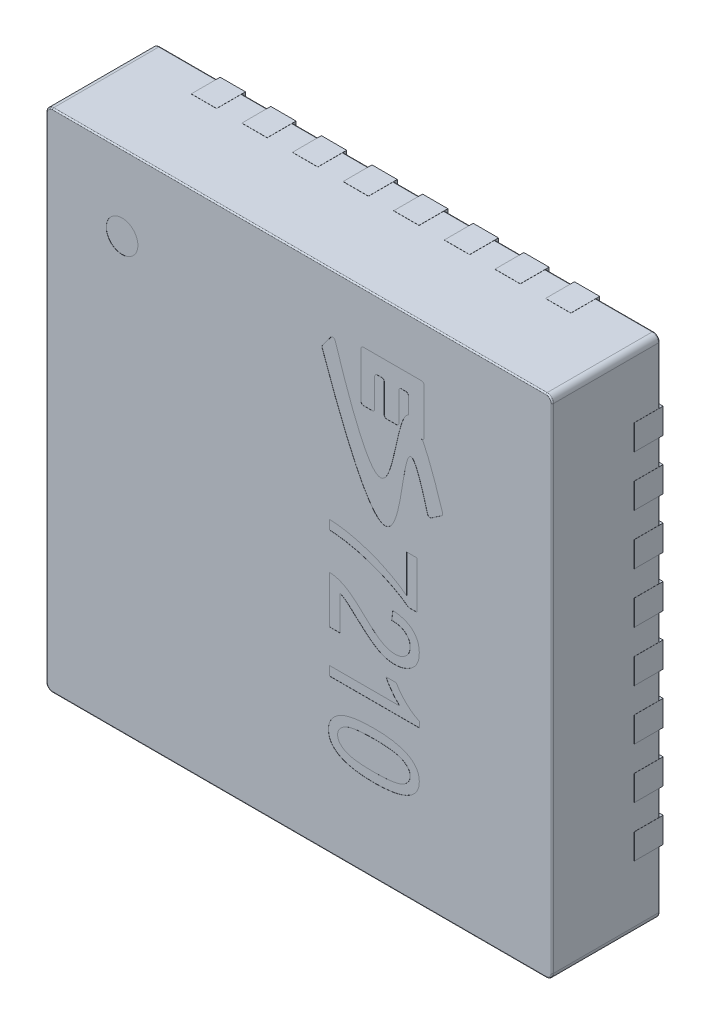
from build123d import *

# Parameters (mm, degrees)
SKETCH1_W                = 4
SKETCH1_H                = 4
BOSS_EXTRUDE1_DEPTH      = 0.85
FILLET1_R                = 0.05
FILLET2_R                = 0.01
BOSS_EXTRUDE2_DEPTH      = 0.025
BOSS_EXTRUDE2_DEPTH_BACK = 0.203
SKETCH2_W                = 0.2
SKETCH2_H                = 0.3
SKETCH2_W_2              = 0.3
SKETCH2_H_2              = 0.2
SKETCH3_R                = 0.125
CUT_EXTRUDE1_DEPTH       = 0.001
BODY_MOVE_COPY1_ANGLE    = 180


with BuildPart() as part:
    # Sketch1 → Boss-Extrude1 (new body)
    with BuildSketch(Plane(origin=(0, 0, 0), x_dir=(1, 0, 0), z_dir=(0, 1, 0))):
        Rectangle(SKETCH1_W, SKETCH1_H)
    extrude(amount=BOSS_EXTRUDE1_DEPTH)

    # Fillet1
    fillet1_edges = [part.edges().sort_by_distance(p)[0] for p in [
        (2, 0.425, 2),
        (-2, 0.425, 2),
        (-2, 0.425, -2),
        (2, 0.425, -2),
    ]]
    fillet(fillet1_edges, radius=FILLET1_R)

    # Fillet2
    fillet2_edges = [part.edges().sort_by_distance(p)[0] for p in [
        (0, 0, -2),
        (0, 0.85, -2),
        (2, 0, 0),
        (0, 0, 2),
        (-2, 0, 0),
        (-1.985355339, 0, -1.985355339),
        (-1.985355339, 0, 1.985355339),
        (1.985355339, 0, 1.985355339),
        (1.985355339, 0, -1.985355339),
        (2, 0.85, 0),
        (-2, 0.85, 0),
        (0, 0.85, 2),
        (-1.985355339, 0.85, -1.985355339),
        (-1.985355339, 0.85, 1.985355339),
        (1.985355339, 0.85, 1.985355339),
        (1.985355339, 0.85, -1.985355339),
    ]]
    fillet(fillet2_edges, radius=FILLET2_R)

    # Sketch2 → Boss-Extrude2 (add, two sides: drawn at the far end of the back side and taken through both)
    with BuildSketch(Plane.XZ.offset(-BOSS_EXTRUDE2_DEPTH_BACK)):
        with BuildLine():
            Line((1.1, 1.4), (1.4, 1.1))
            Line((1.4, 1.1), (1.4, -1.35))
            ThreePointArc((1.4, -1.35), (1.385355339, -1.385355339), (1.35, -1.4))
            Line((1.35, -1.4), (-1.35, -1.4))
            ThreePointArc((-1.35, -1.4), (-1.385355339, -1.385355339), (-1.4, -1.35))
            Line((-1.4, -1.35), (-1.4, 1.35))
            ThreePointArc((-1.4, 1.35), (-1.385355339, 1.385355339), (-1.35, 1.4))
            Line((-1.35, 1.4), (1.1, 1.4))
        make_face()
        with Locations((-0.2, 1.851)):
            Rectangle(SKETCH2_W, SKETCH2_H)
        with Locations((-0.6, 1.851)):
            Rectangle(SKETCH2_W, SKETCH2_H)
        with Locations((-1, 1.851)):
            Rectangle(SKETCH2_W, SKETCH2_H)
        with Locations((-1.4, 1.851)):
            Rectangle(SKETCH2_W, SKETCH2_H)
        with Locations((1.4, 1.851)):
            Rectangle(SKETCH2_W, SKETCH2_H)
        with Locations((1, 1.851)):
            Rectangle(SKETCH2_W, SKETCH2_H)
        with Locations((0.6, 1.851)):
            Rectangle(SKETCH2_W, SKETCH2_H)
        with Locations((0.2, 1.851)):
            Rectangle(SKETCH2_W, SKETCH2_H)
        with Locations((0.2, -1.851)):
            Rectangle(SKETCH2_W, SKETCH2_H)
        with Locations((0.6, -1.851)):
            Rectangle(SKETCH2_W, SKETCH2_H)
        with Locations((1, -1.851)):
            Rectangle(SKETCH2_W, SKETCH2_H)
        with Locations((1.4, -1.851)):
            Rectangle(SKETCH2_W, SKETCH2_H)
        with Locations((-1.4, -1.851)):
            Rectangle(SKETCH2_W, SKETCH2_H)
        with Locations((-1, -1.851)):
            Rectangle(SKETCH2_W, SKETCH2_H)
        with Locations((-0.6, -1.851)):
            Rectangle(SKETCH2_W, SKETCH2_H)
        with Locations((-0.2, -1.851)):
            Rectangle(SKETCH2_W, SKETCH2_H)
        with Locations((1.851, 0.2)):
            Rectangle(SKETCH2_W_2, SKETCH2_H_2)
        with Locations((1.851, 0.6)):
            Rectangle(SKETCH2_W_2, SKETCH2_H_2)
        with Locations((1.851, 1)):
            Rectangle(SKETCH2_W_2, SKETCH2_H_2)
        with Locations((1.851, 1.4)):
            Rectangle(SKETCH2_W_2, SKETCH2_H_2)
        with Locations((1.851, -1.4)):
            Rectangle(SKETCH2_W_2, SKETCH2_H_2)
        with Locations((1.851, -1)):
            Rectangle(SKETCH2_W_2, SKETCH2_H_2)
        with Locations((1.851, -0.6)):
            Rectangle(SKETCH2_W_2, SKETCH2_H_2)
        with Locations((1.851, -0.2)):
            Rectangle(SKETCH2_W_2, SKETCH2_H_2)
        with Locations((-1.851, -0.2)):
            Rectangle(SKETCH2_W_2, SKETCH2_H_2)
        with Locations((-1.851, -0.6)):
            Rectangle(SKETCH2_W_2, SKETCH2_H_2)
        with Locations((-1.851, -1)):
            Rectangle(SKETCH2_W_2, SKETCH2_H_2)
        with Locations((-1.851, -1.4)):
            Rectangle(SKETCH2_W_2, SKETCH2_H_2)
        with Locations((-1.851, 1.4)):
            Rectangle(SKETCH2_W_2, SKETCH2_H_2)
        with Locations((-1.851, 1)):
            Rectangle(SKETCH2_W_2, SKETCH2_H_2)
        with Locations((-1.851, 0.6)):
            Rectangle(SKETCH2_W_2, SKETCH2_H_2)
        with Locations((-1.851, 0.2)):
            Rectangle(SKETCH2_W_2, SKETCH2_H_2)
    extrude(amount=BOSS_EXTRUDE2_DEPTH + BOSS_EXTRUDE2_DEPTH_BACK)

    # Sketch3 → Cut-Extrude1 (cut)
    # profile 1 of 6: a face of its own
    with BuildSketch(Plane(origin=(0, 0.85, 0), x_dir=(1, 0, 0), z_dir=(0, 1, 0))):
        with Locations(Location((1.4, -1.4, 0), (0, 0, 270))):
            Circle(SKETCH3_R)
    # profile 2 of 6: a face of its own
    with BuildSketch(Plane(origin=(0, 0.85, 0), x_dir=(1, 0, 0), z_dir=(0, 1, 0))):
        with BuildLine():
            Line((-0.967195361, -1.594112014), (-0.507195361, -1.594112014))
            ThreePointArc((-0.507195361, -1.594112014), (-0.493053225, -1.58825415), (-0.487195361, -1.574112014))
            Line((-0.487195361, -1.574112014), (-0.487195361, -1.214112014))
            ThreePointArc((-0.487195361, -1.214112014), (-0.493053225, -1.199969879), (-0.507195361, -1.194112014))
            Line((-0.507195361, -1.194112014), (-0.576695361, -1.194112014))
            ThreePointArc((-0.576695361, -1.194112014), (-0.590837496, -1.199969879), (-0.596695361, -1.214112014))
            Line((-0.596695361, -1.214112014), (-0.596695361, -1.43881669))
            ThreePointArc((-0.596695361, -1.43881669), (-0.602553225, -1.452958826), (-0.616695361, -1.45881669))
            Line((-0.616695361, -1.45881669), (-0.651695361, -1.45881669))
            ThreePointArc((-0.651695361, -1.45881669), (-0.665837496, -1.452958826), (-0.671695361, -1.43881669))
            Line((-0.671695361, -1.43881669), (-0.671695361, -1.214112014))
            ThreePointArc((-0.671695361, -1.214112014), (-0.677553225, -1.199969879), (-0.691695361, -1.194112014))
            Line((-0.691695361, -1.194112014), (-0.767195361, -1.194112014))
            ThreePointArc((-0.767195361, -1.194112014), (-0.781337496, -1.199969879), (-0.787195361, -1.214112014))
            Line((-0.787195361, -1.214112014), (-0.787195361, -1.43881669))
            ThreePointArc((-0.787195361, -1.43881669), (-0.793053225, -1.452958826), (-0.807195361, -1.45881669))
            Line((-0.807195361, -1.45881669), (-0.842195361, -1.45881669))
            ThreePointArc((-0.842195361, -1.45881669), (-0.856337496, -1.452958826), (-0.862195361, -1.43881669))
            Line((-0.862195361, -1.43881669), (-0.862195361, -1.307431039))
            add(Edge.make_bspline(
                [(-0.862195361, -1.307431039), (-0.709994935, -1.242658459), (-0.771564782, 0.001033819), (-0.284294728, -1.527332574)],
                knots=[0, 0, 0, 0, 1, 1, 1, 1], degree=3))
            ThreePointArc((-0.284294728, -1.527332574), (-0.268507259, -1.540988775), (-0.249160324, -1.53315091))
            Line((-0.249160324, -1.53315091), (-0.183916313, -1.444943735))
            ThreePointArc((-0.183916313, -1.444943735), (-0.180216037, -1.436010858), (-0.18113868, -1.426386043))
            add(Edge.make_bspline(
                [(-1.013763344, -0.705263683), (-0.67867948, -1.952511139), (-1.02099538, 0.950043529), (-0.18113868, -1.426386043)],
                knots=[0, 0, 0, 0, 1, 1, 1, 1], degree=3))
            ThreePointArc((-1.013763344, -0.705263683), (-1.026156587, -0.691688839), (-1.044396518, -0.693963431))
            Line((-1.044396518, -0.693963431), (-1.125676764, -0.749752966))
            ThreePointArc((-1.125676764, -0.749752966), (-1.133273701, -0.759744551), (-1.133420709, -0.772295392))
            add(Edge.make_bspline(
                [(-1.133420709, -0.772295392), (-1.068956851, -0.975303912), (-1.017273228, -1.1102017), (-0.97506474, -1.194112014)],
                knots=[0, 0, 0, 0, 1, 1, 1, 1], degree=3))
            Line((-0.97506474, -1.194112014), (-0.967195361, -1.194112014))
            ThreePointArc((-0.967195361, -1.194112014), (-0.981337496, -1.199969879), (-0.987195361, -1.214112014))
            Line((-0.987195361, -1.214112014), (-0.987195361, -1.574112014))
            ThreePointArc((-0.987195361, -1.574112014), (-0.981337496, -1.58825415), (-0.967195361, -1.594112014))
        make_face()
    # profile 3 of 6: a face of its own
    with BuildSketch(Plane(origin=(0, 0.85, 0), x_dir=(1, 0, 0), z_dir=(0, 1, 0))):
        with BuildLine():
            Line((-0.849090909, -0.363636364), (-0.930909091, -0.363636364))
            Line((-0.930909091, -0.363636364), (-0.930909091, 0.009090909))
            Line((-0.930909091, 0.009090909), (-0.864005682, 0.009090909))
            add(Edge.make_bspline(
                [(-0.864005682, 0.009090909), (-0.854746998, 0.002175362), (-0.835901379, -0.011900911), (-0.805755794, -0.031586208), (-0.773650229, -0.050730904), (-0.739557737, -0.069353456), (-0.703367983, -0.087233057), (-0.665197538, -0.104558207), (-0.624931677, -0.121118576), (-0.583090128, -0.137068866), (-0.540254593, -0.151918182), (-0.497083227, -0.16510485), (-0.453981374, -0.176674327), (-0.410979444, -0.186394912), (-0.368129646, -0.194739112), (-0.325383412, -0.201237901), (-0.282690704, -0.206142227), (-0.254213856, -0.208109146), (-0.24, -0.209090909)],
                knots=[0, 0, 0, 0, 0.828228242, 1.685820058, 2.579325365, 3.507361607, 4.469713273, 5.472243924, 6.511632332, 7.590183537, 8.68180921, 9.76082494, 10.825356942, 11.880104434, 12.920528634, 13.95402052, 14.978775448, 16, 16, 16, 16], degree=3))
            Line((-0.24, -0.209090909), (-0.24, -0.281818182))
            add(Edge.make_bspline(
                [(-0.24, -0.281818182), (-0.247484192, -0.281593654), (-0.262751944, -0.281135617), (-0.286093818, -0.279293748), (-0.31036802, -0.276991466), (-0.335550688, -0.27347466), (-0.36165466, -0.26925248), (-0.388669602, -0.264040985), (-0.416654206, -0.258319967), (-0.455000814, -0.249147711), (-0.50299956, -0.23626294), (-0.559526426, -0.217596113), (-0.614832944, -0.196765783), (-0.668124192, -0.172884669), (-0.718861296, -0.147543439), (-0.765950883, -0.120648322), (-0.809548767, -0.093456313), (-0.836155364, -0.073391457), (-0.849090909, -0.063636364)],
                knots=[0, 0, 0, 0, 0.547560405, 1.117023226, 1.712128439, 2.330702075, 2.976322001, 3.646013224, 4.342857794, 5.065247493, 6.529539093, 7.976213993, 9.417556904, 10.850065343, 12.245478746, 13.563746768, 14.815546979, 16, 16, 16, 16], degree=3))
            Line((-0.849090909, -0.063636364), (-0.849090909, -0.363636364))
        make_face()
    # profile 4 of 6: a face of its own
    with BuildSketch(Plane(origin=(0, 0.85, 0), x_dir=(1, 0, 0), z_dir=(0, 1, 0))):
        with BuildLine():
            Line((-0.321818182, 0.454545455), (-0.24, 0.454545455))
            Line((-0.24, 0.454545455), (-0.24, 0.081818182))
            add(Edge.make_bspline(
                [(-0.24, 0.081818182), (-0.24426307, 0.081800924), (-0.252900118, 0.08176596), (-0.266068061, 0.082928403), (-0.279554808, 0.085316741), (-0.293540272, 0.088366408), (-0.307840523, 0.092690492), (-0.322525009, 0.097984014), (-0.337557319, 0.104229742), (-0.353025884, 0.11154357), (-0.369081507, 0.120087491), (-0.385646973, 0.130408658), (-0.403030028, 0.14220296), (-0.421013902, 0.155756146), (-0.43976953, 0.170824383), (-0.459210041, 0.187482032), (-0.479442256, 0.205659527), (-0.492880467, 0.218613041), (-0.499801136, 0.225284091)],
                knots=[0, 0, 0, 0, 0.672196011, 1.361880106, 2.081368845, 2.831486093, 3.618364569, 4.435734711, 5.292876118, 6.184871288, 7.133796945, 8.159796293, 9.26180684, 10.446293416, 11.710635831, 13.056147575, 14.483918136, 16, 16, 16, 16], degree=3))
            add(Edge.make_bspline(
                [(-0.499801136, 0.225284091), (-0.507818635, 0.233035493), (-0.523255706, 0.247960215), (-0.546049487, 0.268965336), (-0.567236023, 0.288050598), (-0.58719843, 0.30483469), (-0.605664825, 0.31961559), (-0.622608804, 0.332542012), (-0.638414902, 0.342996201), (-0.657013047, 0.354283752), (-0.679153843, 0.365044829), (-0.704962445, 0.374558231), (-0.729911682, 0.380705106), (-0.746360183, 0.381454379), (-0.754346591, 0.381818182)],
                knots=[0, 0, 0, 0, 1.312560889, 2.527233899, 3.64818266, 4.668586789, 5.596397896, 6.432357998, 7.175835261, 7.825761013, 8.992224112, 10.065918602, 11.060925749, 12, 12, 12, 12], degree=3))
            add(Edge.make_bspline(
                [(-0.754346591, 0.381818182), (-0.758755733, 0.381767468), (-0.767367248, 0.381668418), (-0.779943296, 0.379984578), (-0.79190563, 0.377584142), (-0.803338086, 0.37441155), (-0.814062267, 0.369925318), (-0.824153051, 0.364488908), (-0.83374334, 0.358272519), (-0.842500123, 0.351018571), (-0.850399964, 0.343089495), (-0.857472155, 0.334713184), (-0.863252685, 0.325748447), (-0.868040858, 0.316380022), (-0.871704489, 0.306551787), (-0.874449565, 0.296288569), (-0.876009053, 0.285558946), (-0.87624427, 0.27827186), (-0.876363636, 0.274573864)],
                knots=[0, 0, 0, 0, 1.164144409, 2.273695819, 3.345940663, 4.387378487, 5.402712487, 6.410231049, 7.41307794, 8.417484468, 9.408318902, 10.367853362, 11.308274301, 12.220303706, 13.142827832, 14.074469365, 15.022846069, 16, 16, 16, 16], degree=3))
            add(Edge.make_bspline(
                [(-0.876363636, 0.274573864), (-0.876280325, 0.270586651), (-0.876117697, 0.262803428), (-0.87408399, 0.251462156), (-0.871386594, 0.240582485), (-0.867122164, 0.230300411), (-0.861968085, 0.220420081), (-0.855240353, 0.211347943), (-0.847732115, 0.202562245), (-0.838923799, 0.194486264), (-0.828921979, 0.187277415), (-0.81799788, 0.180806559), (-0.805879551, 0.175590996), (-0.792866488, 0.171207876), (-0.778802897, 0.167764938), (-0.763732205, 0.165466248), (-0.747660858, 0.163779689), (-0.736595709, 0.163685017), (-0.730909091, 0.163636364)],
                knots=[0, 0, 0, 0, 0.928593091, 1.812656339, 2.680433, 3.537535669, 4.402074609, 5.272376737, 6.164676777, 7.094647554, 8.050991042, 9.035788945, 10.049325173, 11.121325706, 12.235436061, 13.420862991, 14.67452591, 16, 16, 16, 16], degree=3))
            Line((-0.730909091, 0.163636364), (-0.74, 0.090909091))
            add(Edge.make_bspline(
                [(-0.74, 0.090909091), (-0.748439432, 0.091658565), (-0.764812313, 0.093112579), (-0.788514434, 0.096927802), (-0.810506363, 0.102221062), (-0.831004751, 0.108507961), (-0.849764654, 0.116405422), (-0.867129546, 0.12529418), (-0.882797385, 0.13568872), (-0.896794435, 0.147372015), (-0.909067966, 0.160246164), (-0.919735249, 0.174077077), (-0.928986857, 0.188799674), (-0.936330679, 0.204621169), (-0.942056828, 0.221436903), (-0.946150779, 0.239184202), (-0.948592344, 0.257934124), (-0.948922266, 0.270731308), (-0.949090909, 0.277272727)],
                knots=[0, 0, 0, 0, 1.296016433, 2.514330702, 3.668705393, 4.754684394, 5.790583066, 6.778804856, 7.735156204, 8.660808185, 9.562568342, 10.450784178, 11.329227516, 12.217177451, 13.112894374, 14.042449809, 14.999377131, 16, 16, 16, 16], degree=3))
            add(Edge.make_bspline(
                [(-0.949090909, 0.277272727), (-0.94888512, 0.284336003), (-0.948484415, 0.298089374), (-0.945803395, 0.318100515), (-0.941182234, 0.336820222), (-0.934387737, 0.354112812), (-0.926043344, 0.370166283), (-0.915679928, 0.384835443), (-0.903359473, 0.398105014), (-0.889315115, 0.409903257), (-0.874159238, 0.420332793), (-0.85830965, 0.429432486), (-0.842031109, 0.437325939), (-0.825141914, 0.443494846), (-0.80786888, 0.448646554), (-0.789950131, 0.451882967), (-0.771592427, 0.454161379), (-0.759183373, 0.454416706), (-0.752926136, 0.454545455)],
                knots=[0, 0, 0, 0, 1.141316638, 2.222333051, 3.255980828, 4.24919085, 5.217781249, 6.173073686, 7.14226832, 8.135684626, 9.131102602, 10.111468148, 11.086834621, 12.050425614, 13.014198859, 13.995608887, 14.989290351, 16, 16, 16, 16], degree=3))
            add(Edge.make_bspline(
                [(-0.752926136, 0.454545455), (-0.74728864, 0.454424149), (-0.736087094, 0.454183119), (-0.719373752, 0.452615197), (-0.702885109, 0.449847523), (-0.686462619, 0.446253823), (-0.670360569, 0.441154327), (-0.654323184, 0.435381464), (-0.638531527, 0.428379279), (-0.622676798, 0.42011361), (-0.606200181, 0.410433193), (-0.588791407, 0.398843195), (-0.569995805, 0.385483922), (-0.550034164, 0.370083498), (-0.528685701, 0.352887975), (-0.506119852, 0.333675534), (-0.482290533, 0.312510859), (-0.466112621, 0.29761134), (-0.457755682, 0.289914773)],
                knots=[0, 0, 0, 0, 0.780531358, 1.550893666, 2.321451189, 3.094347453, 3.876089108, 4.657940698, 5.453333384, 6.265487087, 7.132311241, 8.097757185, 9.160053187, 10.324349312, 11.587703087, 12.955031265, 14.427076445, 16, 16, 16, 16], degree=3))
            add(Edge.make_bspline(
                [(-0.457755682, 0.289914773), (-0.452560341, 0.285023853), (-0.442631628, 0.275676912), (-0.428229759, 0.26253033), (-0.415313766, 0.250483586), (-0.403556688, 0.239946161), (-0.393210349, 0.23057589), (-0.383936144, 0.222873657), (-0.376185892, 0.216251049), (-0.363766693, 0.206589622), (-0.346248857, 0.19439656), (-0.329773937, 0.185914282), (-0.321818182, 0.181818182)],
                knots=[0, 0, 0, 0, 1.227426371, 2.345710398, 3.354421158, 4.265580894, 5.061720194, 5.755250507, 6.339260457, 6.815034732, 8.461977265, 10, 10, 10, 10], degree=3))
            Line((-0.321818182, 0.181818182), (-0.321818182, 0.454545455))
        make_face()
    # profile 5 of 6: a face of its own
    with BuildSketch(Plane(origin=(0, 0.85, 0), x_dir=(1, 0, 0), z_dir=(0, 1, 0))):
        with BuildLine():
            Line((-0.24, 0.790909091), (-0.24, 0.718181818))
            Line((-0.24, 0.718181818), (-0.794545455, 0.718181818))
            add(Edge.make_bspline(
                [(-0.794545455, 0.718181818), (-0.789406209, 0.713713641), (-0.778755126, 0.70445335), (-0.763589014, 0.688435906), (-0.74812757, 0.670428211), (-0.732928709, 0.650671264), (-0.718452754, 0.630406634), (-0.705488792, 0.610547441), (-0.694402722, 0.591543002), (-0.688356689, 0.578829739), (-0.685454545, 0.572727273)],
                knots=[0, 0, 0, 0, 0.892632118, 1.84997915, 2.889208393, 4.004565423, 5.117638514, 6.154471911, 7.114131986, 8, 8, 8, 8], degree=3))
            Line((-0.685454545, 0.572727273), (-0.767272727, 0.572727273))
            add(Edge.make_bspline(
                [(-0.767272727, 0.572727273), (-0.7731789, 0.582534966), (-0.784940674, 0.60206637), (-0.80529148, 0.629491945), (-0.827428074, 0.655260654), (-0.851244081, 0.678827193), (-0.875686929, 0.700021117), (-0.900196727, 0.718086477), (-0.924396776, 0.732946131), (-0.941048101, 0.740231211), (-0.949090909, 0.74375)],
                knots=[0, 0, 0, 0, 1.082336866, 2.155405958, 3.2255179, 4.292702086, 5.32152541, 6.282639852, 7.170492597, 8, 8, 8, 8], degree=3))
            Line((-0.949090909, 0.74375), (-0.949090909, 0.790909091))
            Line((-0.949090909, 0.790909091), (-0.24, 0.790909091))
        make_face()
    # profile 6 of 6: a face of its own
    with BuildSketch(Plane(origin=(0, 0.85, 0), x_dir=(1, 0, 0), z_dir=(0, 1, 0))):
        with BuildLine():
            add(Edge.make_bspline(
                [(-0.589715909, 0.972727273), (-0.604018412, 0.972842746), (-0.631790432, 0.973066969), (-0.672070511, 0.975384754), (-0.709701389, 0.97903958), (-0.744631111, 0.98401292), (-0.776869964, 0.99073277), (-0.806495774, 0.998693134), (-0.833425548, 1.008355624), (-0.857681068, 1.019358887), (-0.879167991, 1.031844841), (-0.897818713, 1.045855728), (-0.913786485, 1.061190617), (-0.926741469, 1.078163711), (-0.936787277, 1.096515239), (-0.943969801, 1.116283563), (-0.948315262, 1.137452755), (-0.948828858, 1.152062645), (-0.949090909, 1.159517045)],
                knots=[0, 0, 0, 0, 1.522177082, 2.955701814, 4.292601031, 5.54555501, 6.7088804, 7.795771162, 8.808034672, 9.750647735, 10.627079958, 11.44753433, 12.228026558, 12.97593222, 13.711165822, 14.446140298, 15.20717461, 16, 16, 16, 16], degree=3))
            add(Edge.make_bspline(
                [(-0.949090909, 1.159517045), (-0.948898451, 1.16616437), (-0.948520258, 1.179226781), (-0.944775345, 1.198193618), (-0.939192653, 1.216178565), (-0.930954007, 1.232920051), (-0.920463938, 1.248607501), (-0.907559305, 1.263054513), (-0.892514842, 1.276634902), (-0.881106379, 1.284367464), (-0.875227273, 1.288352273)],
                knots=[0, 0, 0, 0, 1.02455918, 2.013323352, 2.972239719, 3.92313388, 4.881632631, 5.875512573, 6.905191138, 8, 8, 8, 8], degree=3))
            add(Edge.make_bspline(
                [(-0.875227273, 1.288352273), (-0.867315948, 1.292978556), (-0.850863515, 1.302599401), (-0.823296953, 1.314083475), (-0.792467372, 1.32379386), (-0.758343858, 1.331894381), (-0.720854533, 1.337775804), (-0.680151477, 1.342361386), (-0.63605856, 1.345034239), (-0.605533942, 1.345311083), (-0.589715909, 1.345454545)],
                knots=[0, 0, 0, 0, 0.745752227, 1.550870435, 2.425309485, 3.376577511, 4.404263406, 5.514061028, 6.71177208, 8, 8, 8, 8], degree=3))
            add(Edge.make_bspline(
                [(-0.589715909, 1.345454545), (-0.575508009, 1.345339679), (-0.547925061, 1.345116681), (-0.507882681, 1.342789238), (-0.470438832, 1.339148535), (-0.435610757, 1.334144961), (-0.403448985, 1.32749018), (-0.373924215, 1.319414876), (-0.346967726, 1.310012172), (-0.322719415, 1.298920409), (-0.301128286, 1.286475993), (-0.282378901, 1.272560755), (-0.26647384, 1.257172642), (-0.253374994, 1.2403548), (-0.243365099, 1.221879068), (-0.236013237, 1.202111944), (-0.23168278, 1.180821383), (-0.231171017, 1.166165697), (-0.230909091, 1.158664773)],
                knots=[0, 0, 0, 0, 1.514074965, 2.939396442, 4.273020662, 5.522618968, 6.687464393, 7.770909357, 8.782798299, 9.726643008, 10.608576586, 11.434138097, 12.208514389, 12.960468265, 13.696662544, 14.439073904, 15.201102606, 16, 16, 16, 16], degree=3))
            add(Edge.make_bspline(
                [(-0.230909091, 1.158664773), (-0.231160532, 1.15197269), (-0.231654895, 1.138815302), (-0.235406136, 1.119506668), (-0.241894033, 1.101244949), (-0.250749067, 1.083847504), (-0.262323586, 1.067583935), (-0.276222215, 1.052070235), (-0.29282167, 1.037676403), (-0.311884488, 1.023965939), (-0.334119856, 1.011652419), (-0.359967347, 1.001259536), (-0.389338845, 0.99233078), (-0.422442957, 0.985299743), (-0.459072672, 0.979406417), (-0.499405681, 0.975644947), (-0.543330957, 0.97318911), (-0.573850401, 0.97288524), (-0.589715909, 0.972727273)],
                knots=[0, 0, 0, 0, 0.713852874, 1.403515076, 2.08903769, 2.775973907, 3.479633763, 4.213082677, 4.993526966, 5.819329379, 6.714934747, 7.698240864, 8.786642223, 9.986811405, 11.306714678, 12.743554856, 14.307139623, 16, 16, 16, 16], degree=3))
        make_face()
        with BuildLine():
            add(Edge.make_bspline(
                [(-0.59, 1.045454545), (-0.576362746, 1.045582775), (-0.550264232, 1.045828176), (-0.512878959, 1.04714288), (-0.479048426, 1.049681979), (-0.448704662, 1.053158536), (-0.421849609, 1.057626522), (-0.398429871, 1.063011269), (-0.378583683, 1.069618979), (-0.361964252, 1.077234836), (-0.348158011, 1.085809443), (-0.336254117, 1.094734298), (-0.32618691, 1.104279625), (-0.317998535, 1.114473455), (-0.311480524, 1.125181694), (-0.306898443, 1.136546313), (-0.304076608, 1.148488786), (-0.303784276, 1.156660679), (-0.303636364, 1.160795455)],
                knots=[0, 0, 0, 0, 1.930680258, 3.694870612, 5.294765573, 6.732327541, 8.017244644, 9.14720992, 10.130763445, 10.973463911, 11.728776188, 12.427251247, 13.076760965, 13.687074849, 14.273357039, 14.844695938, 15.415444712, 16, 16, 16, 16], degree=3))
            add(Edge.make_bspline(
                [(-0.303636364, 1.160795455), (-0.303771292, 1.164697897), (-0.304039957, 1.17246828), (-0.307111753, 1.18379732), (-0.311629517, 1.194709844), (-0.318138479, 1.205094128), (-0.326694789, 1.214718979), (-0.33686558, 1.224025583), (-0.348875226, 1.232809232), (-0.362866628, 1.241196622), (-0.37954861, 1.248889559), (-0.399560936, 1.255237207), (-0.422934717, 1.260694415), (-0.449689604, 1.265206207), (-0.47991193, 1.26844426), (-0.513539966, 1.271052181), (-0.550643453, 1.272347948), (-0.576504959, 1.272597205), (-0.59, 1.272727273)],
                knots=[0, 0, 0, 0, 0.556166894, 1.107416796, 1.665226727, 2.239567038, 2.848554421, 3.499699756, 4.205927923, 4.970429246, 5.826979258, 6.823810641, 7.964115301, 9.254120602, 10.697341843, 12.305131035, 14.071945012, 16, 16, 16, 16], degree=3))
            add(Edge.make_bspline(
                [(-0.59, 1.272727273), (-0.603637194, 1.272597963), (-0.629782908, 1.272350045), (-0.667216227, 1.27104603), (-0.701139571, 1.268488461), (-0.731533806, 1.265036034), (-0.758433561, 1.260553076), (-0.781856712, 1.255174427), (-0.801692953, 1.248551761), (-0.818305559, 1.240997033), (-0.831986808, 1.23231063), (-0.843947512, 1.223511356), (-0.853760052, 1.213706), (-0.862058126, 1.203558786), (-0.868511747, 1.192704261), (-0.873130362, 1.181166714), (-0.875908014, 1.169024214), (-0.876211124, 1.16071495), (-0.876363636, 1.156534091)],
                knots=[0, 0, 0, 0, 1.925955125, 3.692509702, 5.288489091, 6.729174103, 8.01094651, 9.138146317, 10.1192927, 10.959930748, 11.707705856, 12.404471472, 13.052253553, 13.661073759, 14.251664904, 14.827808546, 15.410204315, 16, 16, 16, 16], degree=3))
            add(Edge.make_bspline(
                [(-0.876363636, 1.156534091), (-0.876232565, 1.152630758), (-0.875973125, 1.144904606), (-0.87288399, 1.133673518), (-0.868378763, 1.122889901), (-0.861807267, 1.1126912), (-0.853457529, 1.102991682), (-0.843309993, 1.093724006), (-0.831213625, 1.085121155), (-0.817288195, 1.076620243), (-0.800472537, 1.069274924), (-0.78057564, 1.062709689), (-0.757132816, 1.057540491), (-0.730361187, 1.052968485), (-0.700086698, 1.049741363), (-0.666460457, 1.047128463), (-0.629356426, 1.045834207), (-0.603494999, 1.045584728), (-0.59, 1.045454545)],
                knots=[0, 0, 0, 0, 0.557032304, 1.102574738, 1.655014845, 2.224515005, 2.830031617, 3.482190151, 4.185515023, 4.951205931, 5.812452911, 6.804401212, 7.944931852, 9.243623836, 10.689090768, 12.299381722, 14.068944907, 16, 16, 16, 16], degree=3))
        make_face(mode=Mode.SUBTRACT)
    extrude(amount=-CUT_EXTRUDE1_DEPTH, mode=Mode.SUBTRACT)


with BuildPart() as part_1:
    # Body-Move/Copy1: moved
    add(part.part.rotate(Axis((0, 0, 0), (-4.937700262164522e-15, 0.7071067811865462, 0.7071067811865488)), BODY_MOVE_COPY1_ANGLE))


with BuildPart() as part_2:
    # Body-Move/Copy2: moved
    add(part_1.part.moved(Location((0, 0, 0.025))))


solid = part_2.part
